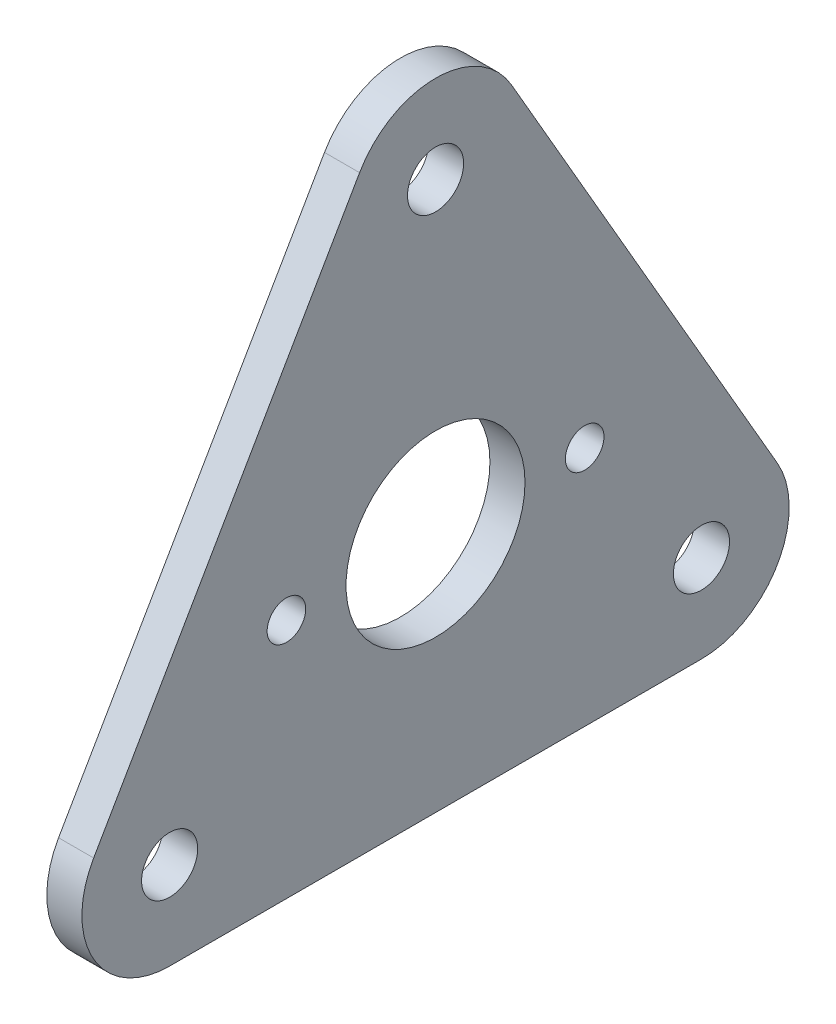
from build123d import *

# Parameters (mm, degrees)
SKETCH_1_R      = 5.1
SKETCH_1_R_2    = 1.6
SKETCH_1_R_3    = 1.1
EXTRUDE_1_DEPTH = 2


with BuildPart() as part:
    # ｽｹｯﾁ1 → ﾎﾞｽ - 押し出し1 (new body)
    with BuildSketch(Plane(origin=(0, 0, 0), x_dir=(0, 0, -1), z_dir=(1, 0, 0))):
        with BuildLine():
            Line((-4.330127019, 20), (-19.485571585, -6.25))
            ThreePointArc((-19.485571585, -6.25), (-19.485571585, -11.25), (-15.155444566, -13.75))
            Line((-15.155444566, -13.75), (15.155444566, -13.75))
            ThreePointArc((15.155444566, -13.75), (19.485571585, -11.25), (19.485571585, -6.25))
            Line((19.485571585, -6.25), (4.330127019, 20))
            ThreePointArc((4.330127019, 20), (0, 22.5), (-4.330127019, 20))
        make_face()
        Circle(SKETCH_1_R, mode=Mode.SUBTRACT)
        with Locations((0, 17.5)):
            Circle(SKETCH_1_R_2, mode=Mode.SUBTRACT)
        with Locations((-8.5, 0)):
            Circle(SKETCH_1_R_3, mode=Mode.SUBTRACT)
        with Locations(Location((8.5, 0, 0), (0, 0, 180))):
            Circle(SKETCH_1_R_3, mode=Mode.SUBTRACT)
        with Locations((15.155444566, -8.75)):
            Circle(SKETCH_1_R_2, mode=Mode.SUBTRACT)
        with BuildLine():
            ThreePointArc((-15.891264638, -7.329236536), (-16.541085212, -9.55), (-14.292937349, -10.097620607))
            ThreePointArc((-14.292937349, -10.097620607), (-13.76980392, -7.95), (-15.891264638, -7.329236536))
        make_face(mode=Mode.SUBTRACT)
    extrude(amount=EXTRUDE_1_DEPTH)


solid = part.part
